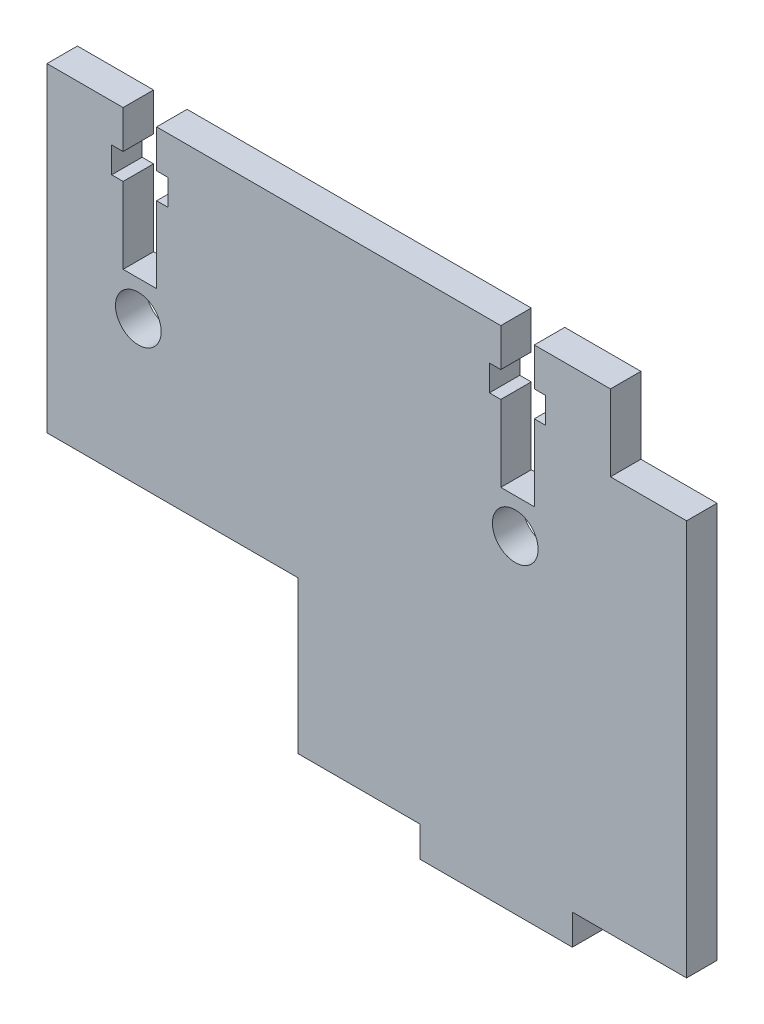
from build123d import *

# Parameters (mm, degrees)
BOSS_EXTRUDE1_DEPTH = 4
SKETCH2_W           = 33
SKETCH2_H           = 20
SKETCH2_W_2         = 10
SKETCH2_H_2         = 10
CUT_EXTRUDE1_DEPTH  = 5
CUT_EXTRUDE2_DEPTH  = 10
SKETCH4_R           = 3
CUT_EXTRUDE3_DEPTH  = 10


with BuildPart() as part:
    # Sketch1 → Boss-Extrude1 (new body)
    with BuildSketch(Plane.XY):
        Polygon((27, -31), (27, -35), (7, -35), (7, -31), (-42, -31), (-42, 31), (42, 31), (42, -31), align=None)
    extrude(amount=BOSS_EXTRUDE1_DEPTH)

    # Sketch2 → Cut-Extrude1 (cut)
    with BuildSketch(Plane(origin=(0, 0, 0), x_dir=(-1, 0, 0), z_dir=(0, 0, -1))):
        with Locations((25.5, -21)):
            Rectangle(SKETCH2_W, SKETCH2_H)
        with Locations((-37, 26)):
            Rectangle(SKETCH2_W_2, SKETCH2_H_2)
    extrude(amount=-CUT_EXTRUDE1_DEPTH, mode=Mode.SUBTRACT)

    # Sketch3 → Cut-Extrude2 (cut)
    with BuildSketch(Plane(origin=(0, 0, 0), x_dir=(-1, 0, 0), z_dir=(0, 0, -1))):
        Polygon((32, 22.6), (32, 12.6), (27.6, 12.6), (27.6, 22.6), (26.1, 22.6), (26.1, 26), (27.6, 26), (27.6, 31), (32, 31), (32, 26), (33.5, 26), (33.5, 22.6), align=None)
        Polygon((-17.6, 22.6), (-17.6, 12.6), (-22, 12.6), (-22, 22.6), (-23.5, 22.6), (-23.5, 26), (-22, 26), (-22, 31), (-17.6, 31), (-17.6, 26), (-16.1, 26), (-16.1, 22.6), align=None)
    extrude(amount=-CUT_EXTRUDE2_DEPTH, mode=Mode.SUBTRACT)

    # Sketch4 → Cut-Extrude3 (cut)
    with BuildSketch(Plane(origin=(0, 0, 0), x_dir=(-1, 0, 0), z_dir=(0, 0, -1))):
        with Locations((30, 8)):
            Circle(SKETCH4_R)
        with Locations((-19.5, 8)):
            Circle(SKETCH4_R)
    extrude(amount=-CUT_EXTRUDE3_DEPTH, mode=Mode.SUBTRACT)


solid = part.part
